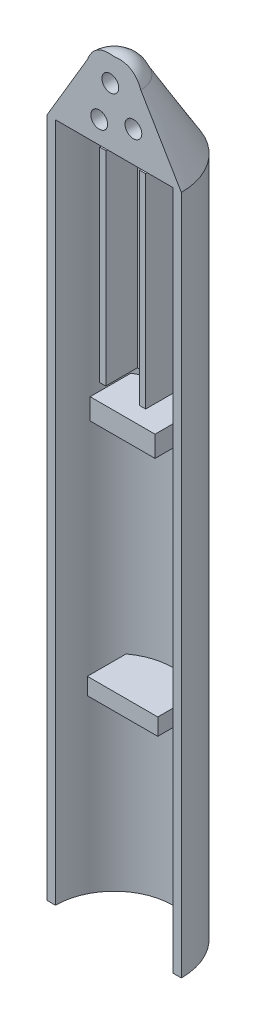
from build123d import *

# Parameters (mm, degrees)
SKETCH2_W           = 2
SKETCH2_H           = 162.039928857
SKETCH5_W           = 72.783621468
SKETCH5_H           = 192.84631039
CUT_EXTRUDE1_DEPTH  = 94.869329042
BOSS_EXTRUDE1_REACH = 97.869
BOSS_EXTRUDE1_START = -2
SKETCH4_W           = 15.457813272
SKETCH4_H           = 5
SKETCH4_W_2         = 16.763190872
SKETCH4_H_2         = 4
SKETCH4_W_3         = 1.5
SKETCH4_H_3         = 48.554461885
BOSS_EXTRUDE2_REACH = 105.369
BOSS_EXTRUDE2_START = -9.5
SKETCH4_4_W         = 8
SKETCH4_4_H         = 48.554461885
SKETCH6_R           = 2
CUT_EXTRUDE2_DEPTH  = 4


with BuildPart() as part:
    # Sketch1 → Revolve1 (revolve)
    with BuildSketch(Plane.XY):
        with BuildLine():
            Line((6.354000149, 87.279039692), (16, 71))
            Line((16, 71), (0, 71))
            Line((0, 71), (0, 91))
            add(Edge.make_bspline(
                [(0, 91), (4.668589185, 91.723642341), (6.354000149, 87.279039692)],
                knots=[0, 0, 0, 1, 1, 1], degree=2))
        make_face()
    revolve(axis=Axis((0, 91, 0), (0, -1, 0)))

    # Sketch2 → Revolve2 (revolve)
    with BuildSketch(Plane.XY):
        with Locations((15, -10.019964429)):
            Rectangle(SKETCH2_W, SKETCH2_H)
    revolve(axis=Axis((0, 91, 0), (0, -1, 0)))

    # Sketch5 → Cut-Extrude1 (cut, through all)
    with BuildSketch(Plane.XY):
        Rectangle(SKETCH5_W, SKETCH5_H)
    extrude(amount=CUT_EXTRUDE1_DEPTH, mode=Mode.SUBTRACT)

    # Sketch4 → Boss-Extrude1 (add, up to next)
    with BuildSketch(Plane.XY.offset(BOSS_EXTRUDE1_START), mode=Mode.PRIVATE) as boss_extrude1_sk1:
        with Locations((0, 13.5)):
            Rectangle(SKETCH4_W, SKETCH4_H)
    boss_extrude1_tool1 = extrude(boss_extrude1_sk1.sketch, amount=-BOSS_EXTRUDE1_REACH, mode=Mode.PRIVATE) - part.part
    # Sketch4 → Boss-Extrude1 (add, up to next)
    with BuildSketch(Plane.XY.offset(BOSS_EXTRUDE1_START), mode=Mode.PRIVATE) as boss_extrude1_sk2:
        with Locations((0, -44)):
            Rectangle(SKETCH4_W_2, SKETCH4_H_2)
    boss_extrude1_tool2 = extrude(boss_extrude1_sk2.sketch, amount=-BOSS_EXTRUDE1_REACH, mode=Mode.PRIVATE) - part.part
    # Sketch4 → Boss-Extrude1 (add, up to next)
    with BuildSketch(Plane.XY.offset(BOSS_EXTRUDE1_START), mode=Mode.PRIVATE) as boss_extrude1_sk3:
        with Locations((4.75, 44.344804049)):
            Rectangle(SKETCH4_W_3, SKETCH4_H_3)
    boss_extrude1_tool3 = extrude(boss_extrude1_sk3.sketch, amount=-BOSS_EXTRUDE1_REACH, mode=Mode.PRIVATE) - part.part
    # Sketch4 → Boss-Extrude1 (add, up to next)
    with BuildSketch(Plane.XY.offset(BOSS_EXTRUDE1_START), mode=Mode.PRIVATE) as boss_extrude1_sk4:
        with Locations((-4.75, 44.344804049)):
            Rectangle(SKETCH4_W_3, SKETCH4_H_3)
    boss_extrude1_tool4 = extrude(boss_extrude1_sk4.sketch, amount=-BOSS_EXTRUDE1_REACH, mode=Mode.PRIVATE) - part.part
    add(boss_extrude1_tool1.solids().sort_by_distance((0, 13.5, -2))[0])
    add(boss_extrude1_tool2.solids().sort_by_distance((0, -44, -2))[0])
    add(boss_extrude1_tool3.solids().sort_by_distance((4.75, 44.344804, -2))[0])
    add(boss_extrude1_tool4.solids().sort_by_distance((-4.75, 44.344804, -2))[0])

    # Sketch4<4> → Boss-Extrude2 (add, up to next)
    with BuildSketch(Plane.XY.offset(BOSS_EXTRUDE2_START), mode=Mode.PRIVATE) as boss_extrude2_sk1:
        with Locations((0, 44.344804049)):
            Rectangle(SKETCH4_4_W, SKETCH4_4_H)
    boss_extrude2_tool1 = extrude(boss_extrude2_sk1.sketch, amount=-BOSS_EXTRUDE2_REACH, mode=Mode.PRIVATE) - part.part
    add(boss_extrude2_tool1.solids().sort_by_distance((0, 44.344804, -9.5))[0])

    # Sketch6 → Cut-Extrude2 (cut)
    with BuildSketch(Plane.XY):
        with Locations((4.579301858, 78.367512537)):
            Circle(SKETCH6_R)
        with Locations((-3.558513385, 76.255407818)):
            Circle(SKETCH6_R)
        with Locations((-0.919296183, 85.076551058)):
            Circle(SKETCH6_R)
    extrude(amount=-CUT_EXTRUDE2_DEPTH, mode=Mode.SUBTRACT)


solid = part.part
